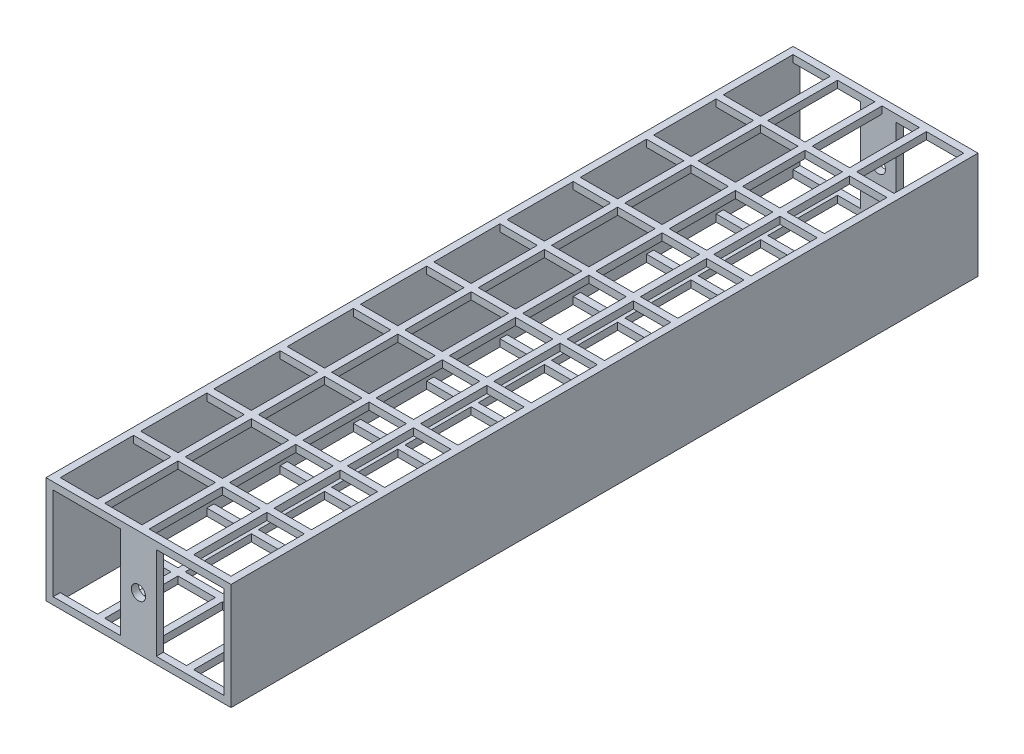
from build123d import *

# Parameters (mm, degrees)
CROQUIS2_W              = 52
CROQUIS2_H              = 210
CROQUIS2_W_2            = 10.5
CROQUIS2_H_2            = 20.615569736
CROQUIS2_H_3            = 18.6
CROQUIS2_H_4            = 17.584430264
CROQUIS2_H_5            = 19.6
SALIENTE_EXTRUIR2_DEPTH = 30
CROQUIS3_W              = 48
CROQUIS3_H              = 26
CORTAR_EXTRUIR1_DEPTH   = 219
CROQUIS4_W              = 10
CROQUIS4_H              = 30
SALIENTE_EXTRUIR3_DEPTH = 2
CORTAR_EXTRUIR2_DEPTH   = 2
CROQUIS6_W              = 10
CROQUIS6_H              = 26
SALIENTE_EXTRUIR4_DEPTH = 2
CORTAR_EXTRUIR3_START   = -2
CORTAR_EXTRUIR3_DEPTH   = 2


with BuildPart() as part:
    # Croquis2 → Saliente-Extruir2 (new body)
    with BuildSketch(Plane(origin=(0, 0, 0), x_dir=(1, 0, 0), z_dir=(0, 1, 0))):
        with Locations((0, 3.525581151)):
            Rectangle(CROQUIS2_W, CROQUIS2_H)
        with Locations((-18.75, -89.166633981)):
            Rectangle(CROQUIS2_W_2, CROQUIS2_H_2, mode=Mode.SUBTRACT)
        with Locations((-18.75, -67.558849113)):
            Rectangle(CROQUIS2_W_2, CROQUIS2_H_3, mode=Mode.SUBTRACT)
        with Locations((-6.25, -89.166633981)):
            Rectangle(CROQUIS2_W_2, CROQUIS2_H_2, mode=Mode.SUBTRACT)
        with Locations((-6.25, -67.558849113)):
            Rectangle(CROQUIS2_W_2, CROQUIS2_H_3, mode=Mode.SUBTRACT)
        with Locations((-18.75, -46.958849113)):
            Rectangle(CROQUIS2_W_2, CROQUIS2_H_3, mode=Mode.SUBTRACT)
        with Locations((-18.75, -26.358849113)):
            Rectangle(CROQUIS2_W_2, CROQUIS2_H_3, mode=Mode.SUBTRACT)
        with Locations((-18.75, -5.758849113)):
            Rectangle(CROQUIS2_W_2, CROQUIS2_H_3, mode=Mode.SUBTRACT)
        with Locations((-6.25, -46.958849113)):
            Rectangle(CROQUIS2_W_2, CROQUIS2_H_3, mode=Mode.SUBTRACT)
        with Locations((-6.25, -26.358849113)):
            Rectangle(CROQUIS2_W_2, CROQUIS2_H_3, mode=Mode.SUBTRACT)
        with Locations((-6.25, -5.758849113)):
            Rectangle(CROQUIS2_W_2, CROQUIS2_H_3, mode=Mode.SUBTRACT)
        with Locations((6.25, -89.166633981)):
            Rectangle(CROQUIS2_W_2, CROQUIS2_H_2, mode=Mode.SUBTRACT)
        with Locations((6.25, -67.558849113)):
            Rectangle(CROQUIS2_W_2, CROQUIS2_H_3, mode=Mode.SUBTRACT)
        with Locations((18.75, -89.166633981)):
            Rectangle(CROQUIS2_W_2, CROQUIS2_H_2, mode=Mode.SUBTRACT)
        with Locations((6.25, -46.958849113)):
            Rectangle(CROQUIS2_W_2, CROQUIS2_H_3, mode=Mode.SUBTRACT)
        with Locations((18.75, -67.558849113)):
            Rectangle(CROQUIS2_W_2, CROQUIS2_H_3, mode=Mode.SUBTRACT)
        with Locations((18.75, -46.958849113)):
            Rectangle(CROQUIS2_W_2, CROQUIS2_H_3, mode=Mode.SUBTRACT)
        with Locations((6.25, -26.358849113)):
            Rectangle(CROQUIS2_W_2, CROQUIS2_H_3, mode=Mode.SUBTRACT)
        with Locations((6.25, -5.758849113)):
            Rectangle(CROQUIS2_W_2, CROQUIS2_H_3, mode=Mode.SUBTRACT)
        with Locations((18.75, -26.358849113)):
            Rectangle(CROQUIS2_W_2, CROQUIS2_H_3, mode=Mode.SUBTRACT)
        with Locations((18.75, -5.758849113)):
            Rectangle(CROQUIS2_W_2, CROQUIS2_H_3, mode=Mode.SUBTRACT)
        with Locations((-18.75, 14.841150887)):
            Rectangle(CROQUIS2_W_2, CROQUIS2_H_3, mode=Mode.SUBTRACT)
        with Locations((-18.75, 35.441150887)):
            Rectangle(CROQUIS2_W_2, CROQUIS2_H_3, mode=Mode.SUBTRACT)
        with Locations((-6.25, 14.841150887)):
            Rectangle(CROQUIS2_W_2, CROQUIS2_H_3, mode=Mode.SUBTRACT)
        with Locations((-6.25, 35.441150887)):
            Rectangle(CROQUIS2_W_2, CROQUIS2_H_3, mode=Mode.SUBTRACT)
        with Locations((-18.75, 56.041150887)):
            Rectangle(CROQUIS2_W_2, CROQUIS2_H_3, mode=Mode.SUBTRACT)
        with Locations((-18.75, 76.133366019)):
            Rectangle(CROQUIS2_W_2, CROQUIS2_H_4, mode=Mode.SUBTRACT)
        with Locations((-18.75, 96.725581151)):
            Rectangle(CROQUIS2_W_2, CROQUIS2_H_5, mode=Mode.SUBTRACT)
        with Locations((-6.25, 56.041150887)):
            Rectangle(CROQUIS2_W_2, CROQUIS2_H_3, mode=Mode.SUBTRACT)
        with Locations((-6.25, 76.133366019)):
            Rectangle(CROQUIS2_W_2, CROQUIS2_H_4, mode=Mode.SUBTRACT)
        with Locations((-6.25, 96.725581151)):
            Rectangle(CROQUIS2_W_2, CROQUIS2_H_5, mode=Mode.SUBTRACT)
        with Locations((6.25, 14.841150887)):
            Rectangle(CROQUIS2_W_2, CROQUIS2_H_3, mode=Mode.SUBTRACT)
        with Locations((6.25, 35.441150887)):
            Rectangle(CROQUIS2_W_2, CROQUIS2_H_3, mode=Mode.SUBTRACT)
        with Locations((18.75, 14.841150887)):
            Rectangle(CROQUIS2_W_2, CROQUIS2_H_3, mode=Mode.SUBTRACT)
        with Locations((18.75, 35.441150887)):
            Rectangle(CROQUIS2_W_2, CROQUIS2_H_3, mode=Mode.SUBTRACT)
        with Locations((6.25, 56.041150887)):
            Rectangle(CROQUIS2_W_2, CROQUIS2_H_3, mode=Mode.SUBTRACT)
        with Locations((6.25, 76.133366019)):
            Rectangle(CROQUIS2_W_2, CROQUIS2_H_4, mode=Mode.SUBTRACT)
        with Locations((6.25, 96.725581151)):
            Rectangle(CROQUIS2_W_2, CROQUIS2_H_5, mode=Mode.SUBTRACT)
        with Locations((18.75, 56.041150887)):
            Rectangle(CROQUIS2_W_2, CROQUIS2_H_3, mode=Mode.SUBTRACT)
        with Locations((18.75, 76.133366019)):
            Rectangle(CROQUIS2_W_2, CROQUIS2_H_4, mode=Mode.SUBTRACT)
        with Locations((18.75, 96.725581151)):
            Rectangle(CROQUIS2_W_2, CROQUIS2_H_5, mode=Mode.SUBTRACT)
    extrude(amount=SALIENTE_EXTRUIR2_DEPTH)

    # Croquis3 → Cortar-Extruir1 (cut)
    with BuildSketch(Plane(origin=(0, 0, -108.525581151), x_dir=(-1, 0, 0), z_dir=(0, 0, -1))):
        with Locations((0, 15)):
            Rectangle(CROQUIS3_W, CROQUIS3_H)
    extrude(amount=-CORTAR_EXTRUIR1_DEPTH, mode=Mode.SUBTRACT)

    # Croquis4 → Saliente-Extruir3 (add)
    with BuildSketch(Plane.XY.offset(101.474418849)):
        with Locations((0, 15)):
            Rectangle(CROQUIS4_W, CROQUIS4_H)
    extrude(amount=-SALIENTE_EXTRUIR3_DEPTH)

    # Croquis5 → Cortar-Extruir2 (cut)
    with BuildSketch(Plane.XY.offset(101.474418849)):
        with BuildLine():
            ThreePointArc((2, 15), (1.132272865, 16.64862311), (-0.717958159, 16.866691212))
            Line((-0.717958159, 16.866691212), (0.717958159, 13.133308788))
            ThreePointArc((0.717958159, 13.133308788), (1.64862311, 13.867727135), (2, 15))
        make_face()
        with BuildLine():
            Line((0.717958159, 13.133308788), (-0.717958159, 16.866691212))
            ThreePointArc((-0.717958159, 16.866691212), (-1.866691212, 14.282041841), (0.717958159, 13.133308788))
        make_face()
    extrude(amount=-CORTAR_EXTRUIR2_DEPTH, mode=Mode.SUBTRACT)

    # Croquis6 → Saliente-Extruir4 (add)
    with BuildSketch(Plane(origin=(0, 0, -108.525581151), x_dir=(-1, 0, 0), z_dir=(0, 0, -1))):
        with Locations((0, 15)):
            Rectangle(CROQUIS6_W, CROQUIS6_H)
    extrude(amount=-SALIENTE_EXTRUIR4_DEPTH)

    # Croquis7 → Cortar-Extruir3 (cut)
    with BuildSketch(Plane(origin=(0, 0, -108.525581151), x_dir=(-1, 0, 0), z_dir=(0, 0, -1)).offset(CORTAR_EXTRUIR3_START)):
        with BuildLine():
            ThreePointArc((2, 15), (1.132272865, 16.64862311), (-0.717958159, 16.866691212))
            Line((-0.717958159, 16.866691212), (0.717958159, 13.133308788))
            ThreePointArc((0.717958159, 13.133308788), (1.64862311, 13.867727135), (2, 15))
        make_face()
        with BuildLine():
            Line((0.717958159, 13.133308788), (-0.717958159, 16.866691212))
            ThreePointArc((-0.717958159, 16.866691212), (-1.866691212, 14.282041841), (0.717958159, 13.133308788))
        make_face()
    extrude(amount=CORTAR_EXTRUIR3_DEPTH, mode=Mode.SUBTRACT)


solid = part.part
